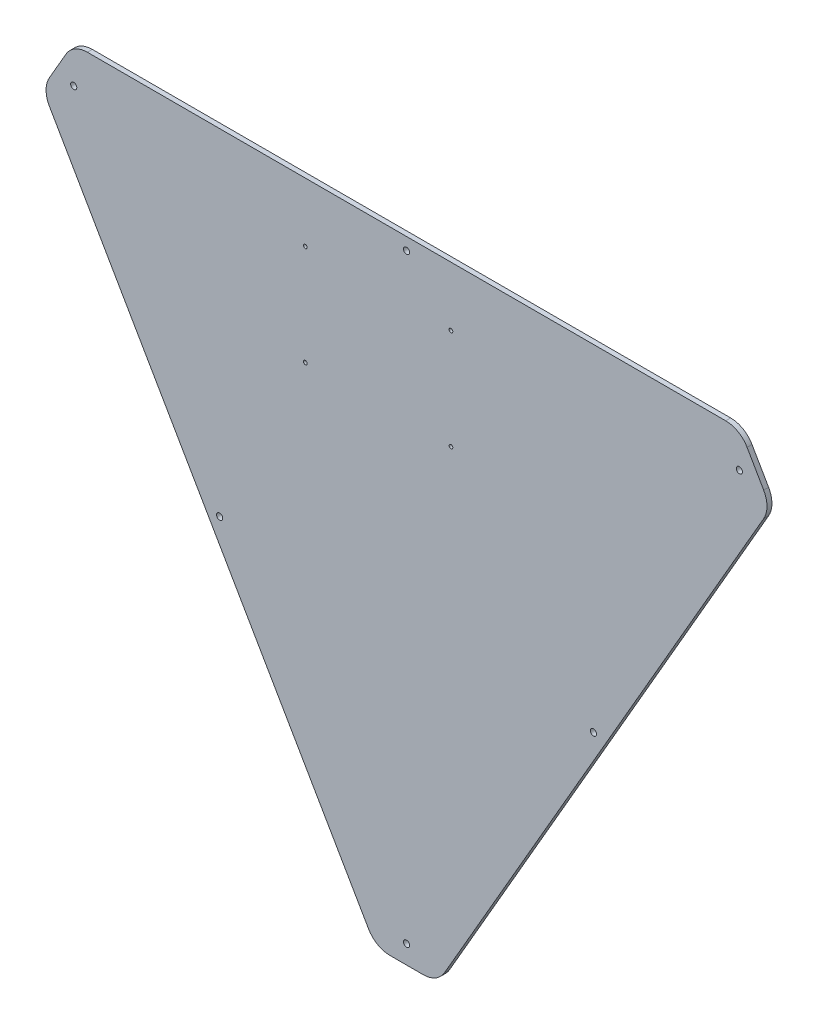
from build123d import *

# Parameters (mm, degrees)
SCHIZZO1_R                   = 2.1
ESTRUSIONE_ESTRUSIONE1_DEPTH = 4
SCHIZZO2_R                   = 2.5
TAGLIO_ESTRUSIONE1_DEPTH     = 4
SCHIZZO3_R                   = 1.5
TAGLIO_ESTRUSIONE3_DEPTH     = 4


with BuildPart() as part:
    # Schizzo1 → Estrusione-Estrusione1 (new body)
    with BuildSketch(Plane.XY):
        with BuildLine():
            Line((69.543022759, -257.170330876), (65.21289574, -264.670330876))
            ThreePointArc((65.21289574, -264.670330876), (57.892387664, -271.990838952), (47.892387664, -274.670330876))
            Line((47.892387664, -274.670330876), (20.986398432, -274.670330876))
            ThreePointArc((20.986398432, -274.670330876), (10.986398432, -271.990838952), (3.665890356, -264.670330876))
            Line((3.665890356, -264.670330876), (-0.664236663, -257.170330876))
            Line((-0.664236663, -257.170330876), (-250.664236663, 175.842371016))
            Line((-250.664236663, 175.842371016), (-254.994363682, 183.342371016))
            ThreePointArc((-254.994363682, 183.342371016), (-257.673855606, 193.342371016), (-254.994363682, 203.342371016))
            Line((-254.994363682, 203.342371016), (-241.541369065, 226.643641206))
            ThreePointArc((-241.541369065, 226.643641206), (-234.22086099, 233.964149281), (-224.22086099, 236.643641206))
            Line((-224.22086099, 236.643641206), (-215.560606952, 236.643641206))
            Line((-215.560606952, 236.643641206), (284.439393048, 236.643641206))
            Line((284.439393048, 236.643641206), (293.099647086, 236.643641206))
            ThreePointArc((293.099647086, 236.643641206), (303.099647086, 233.964149281), (310.420155162, 226.643641206))
            Line((310.420155162, 226.643641206), (323.873149778, 203.342371016))
            ThreePointArc((323.873149778, 203.342371016), (326.552641702, 193.342371016), (323.873149778, 183.342371016))
            Line((323.873149778, 183.342371016), (319.543022759, 175.842371016))
            Line((319.543022759, 175.842371016), (69.543022759, -257.170330876))
        make_face()
        with Locations((34.439393048, -259.670330876)):
            Circle(SCHIZZO1_R, mode=Mode.SUBTRACT)
        with Locations((304.156271413, 207.493006111)):
            Circle(SCHIZZO1_R, mode=Mode.SUBTRACT)
        with Locations((-235.277485317, 207.493006111)):
            Circle(SCHIZZO1_R, mode=Mode.SUBTRACT)
    extrude(amount=ESTRUSIONE_ESTRUSIONE1_DEPTH)

    # Schizzo2 → Taglio-Estrusione1 (cut)
    with BuildSketch(Plane.XY.offset(4)):
        with Locations((34.439393048, 226.643641206)):
            Circle(SCHIZZO2_R)
        with Locations((-235.277485317, 207.493006111)):
            Circle(SCHIZZO2_R)
        with Locations((304.156271413, 207.493006111)):
            Circle(SCHIZZO2_R)
        with Locations((34.439393048, -259.670330876)):
            Circle(SCHIZZO2_R)
        with Locations((185.882768721, -35.66397993)):
            Circle(SCHIZZO2_R)
        with Locations((-117.003982625, -35.66397993)):
            Circle(SCHIZZO2_R)
    extrude(amount=-TAGLIO_ESTRUSIONE1_DEPTH, mode=Mode.SUBTRACT)

    # Schizzo3 → Taglio-Estrusione3 (cut)
    with BuildSketch(Plane.XY.offset(4)):
        with Locations((-47.560606952, 107.143641206)):
            Circle(SCHIZZO3_R)
        with Locations((70.439393048, 107.143641206)):
            Circle(SCHIZZO3_R)
        with Locations(Location((-47.560606952, 188.643641206, 0), (0, 0, 180))):
            Circle(SCHIZZO3_R)
        with Locations(Location((70.439393048, 188.643641206, 0), (0, 0, 180))):
            Circle(SCHIZZO3_R)
    extrude(amount=-TAGLIO_ESTRUSIONE3_DEPTH, mode=Mode.SUBTRACT)


solid = part.part
